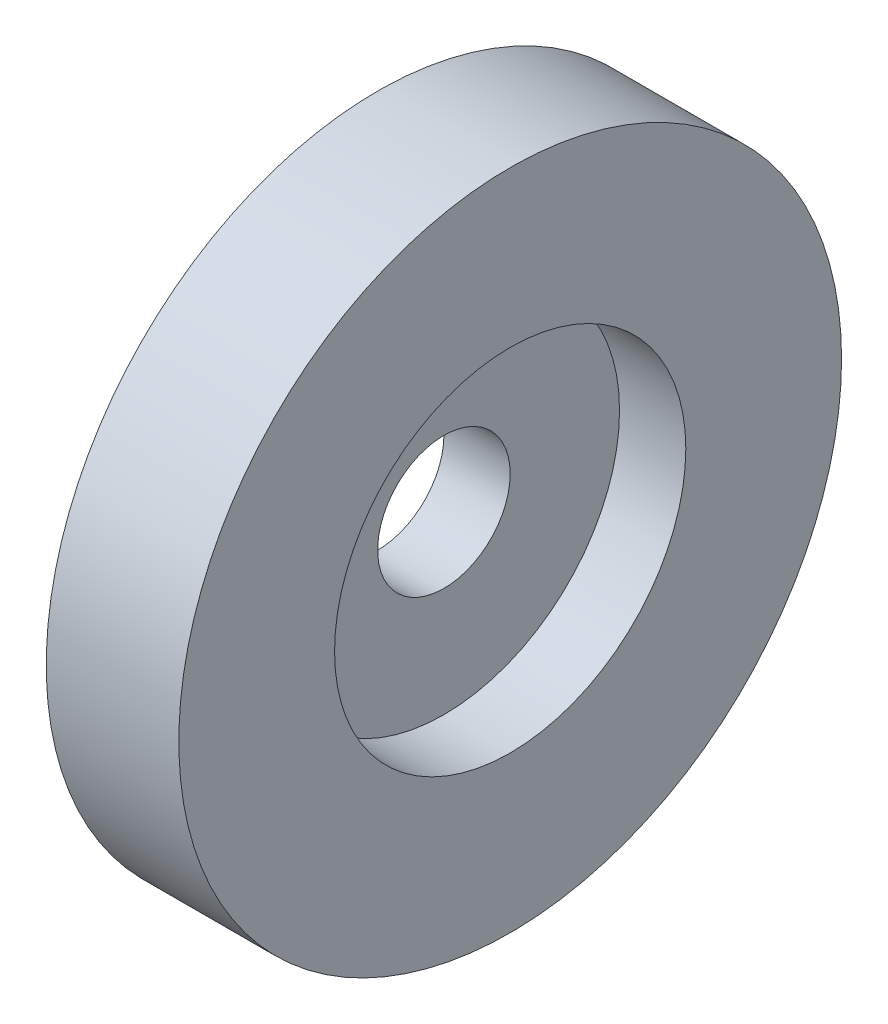
from build123d import *

# Parameters (mm, degrees)
SKETCH_1_R          = 10
EXTRUDE_1_DEPTH     = 4
SKETCH_2_R          = 2
CUT_EXTRUDE_1_DEPTH = 4
SKETCH_4_R          = 5.3
CUT_EXTRUDE_3_DEPTH = 2


with BuildPart() as part:
    # 草图1 → 凸台-拉伸1 (new body)
    with BuildSketch(Plane(origin=(0, 0, 0), x_dir=(0, 0, -1), z_dir=(1, 0, 0))):
        Circle(SKETCH_1_R)
    extrude(amount=EXTRUDE_1_DEPTH)

    # 草图2 → 切除-拉伸1 (cut)
    with BuildSketch(Plane(origin=(4, 0, 0), x_dir=(0, 0, -1), z_dir=(1, 0, 0))):
        Circle(SKETCH_2_R)
    extrude(amount=-CUT_EXTRUDE_1_DEPTH, mode=Mode.SUBTRACT)

    # 草图4 → 切除-拉伸3 (cut)
    with BuildSketch(Plane(origin=(4, 0, 0), x_dir=(0, 0, -1), z_dir=(1, 0, 0))):
        Circle(SKETCH_4_R)
    extrude(amount=-CUT_EXTRUDE_3_DEPTH, mode=Mode.SUBTRACT)


solid = part.part
